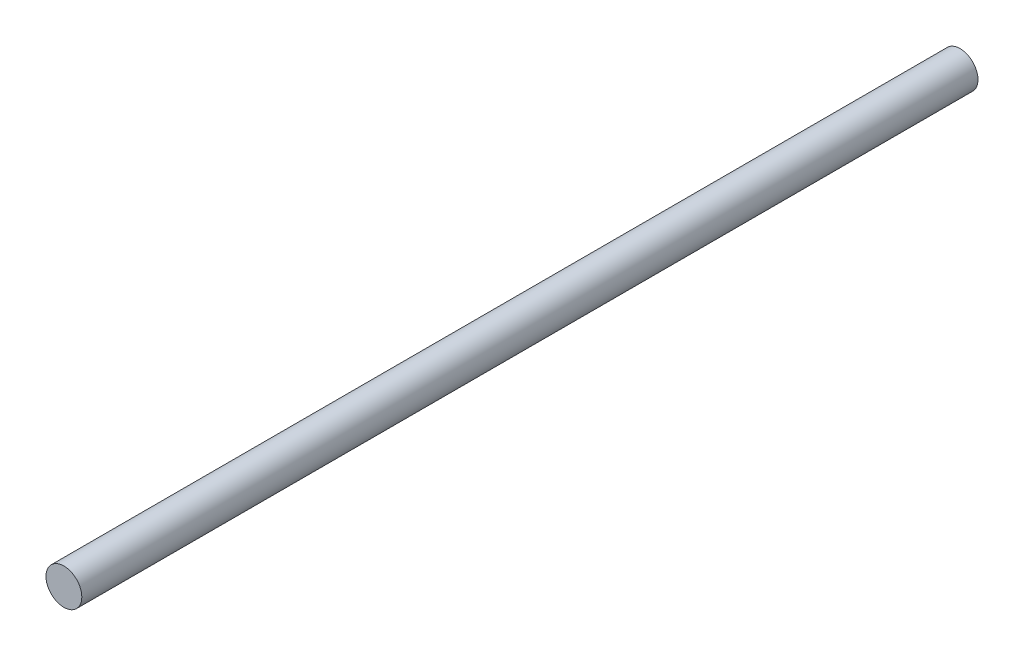
from build123d import *

# Parameters (mm, degrees)
ESQUISSE1_R        = 3
BOSS_EXTRU_1_DEPTH = 150


with BuildPart() as part:
    # Esquisse1 → Boss.-Extru.1 (new body)
    with BuildSketch(Plane.XY):
        Circle(ESQUISSE1_R)
    extrude(amount=BOSS_EXTRU_1_DEPTH)


solid = part.part
